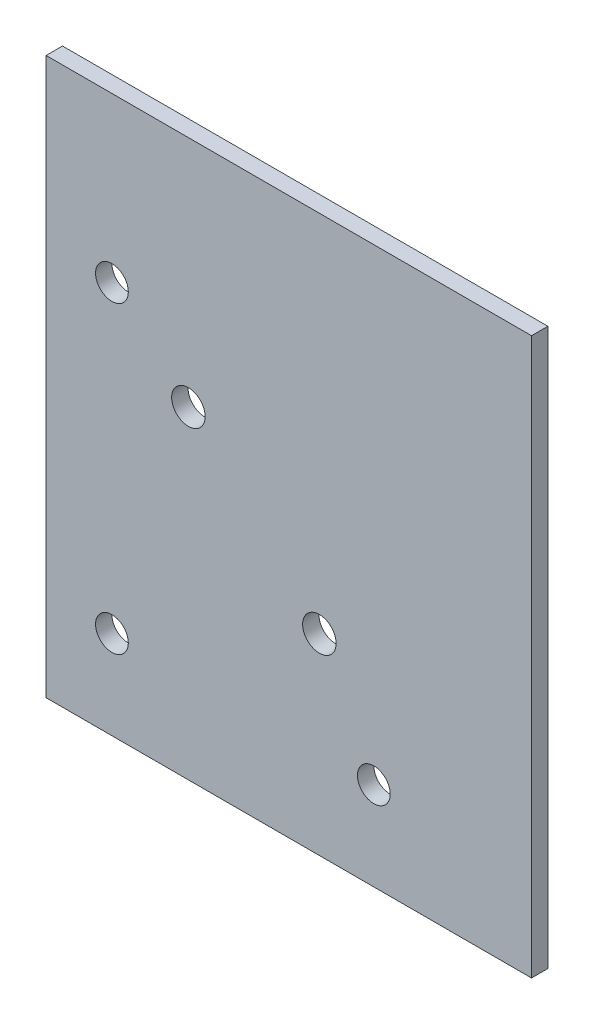
from build123d import *

# Parameters (mm, degrees)
SKETCH1_W           = 94.149921214
SKETCH1_H           = 107.889878539
SKETCH1_R           = 3.175
SKETCH1_R_2         = 3.2512
BOSS_EXTRUDE1_DEPTH = 3.175


with BuildPart() as part:
    # Sketch1 → Boss-Extrude1 (new body)
    with BuildSketch(Plane.XY):
        with Locations((-41.891689505, 154.705348562)):
            Rectangle(SKETCH1_W, SKETCH1_H)
        with Locations((-76.2, 117.928571429)):
            Circle(SKETCH1_R, mode=Mode.SUBTRACT)
        with Locations((-25.4, 117.928571429)):
            Circle(SKETCH1_R, mode=Mode.SUBTRACT)
        with Locations((-76.2, 176.892857143)):
            Circle(SKETCH1_R, mode=Mode.SUBTRACT)
        with Locations((-61.36746069, 163.396667498)):
            Circle(SKETCH1_R_2, mode=Mode.SUBTRACT)
        with Locations((-35.96746069, 137.996667498)):
            Circle(SKETCH1_R_2, mode=Mode.SUBTRACT)
    extrude(amount=BOSS_EXTRUDE1_DEPTH)


solid = part.part
